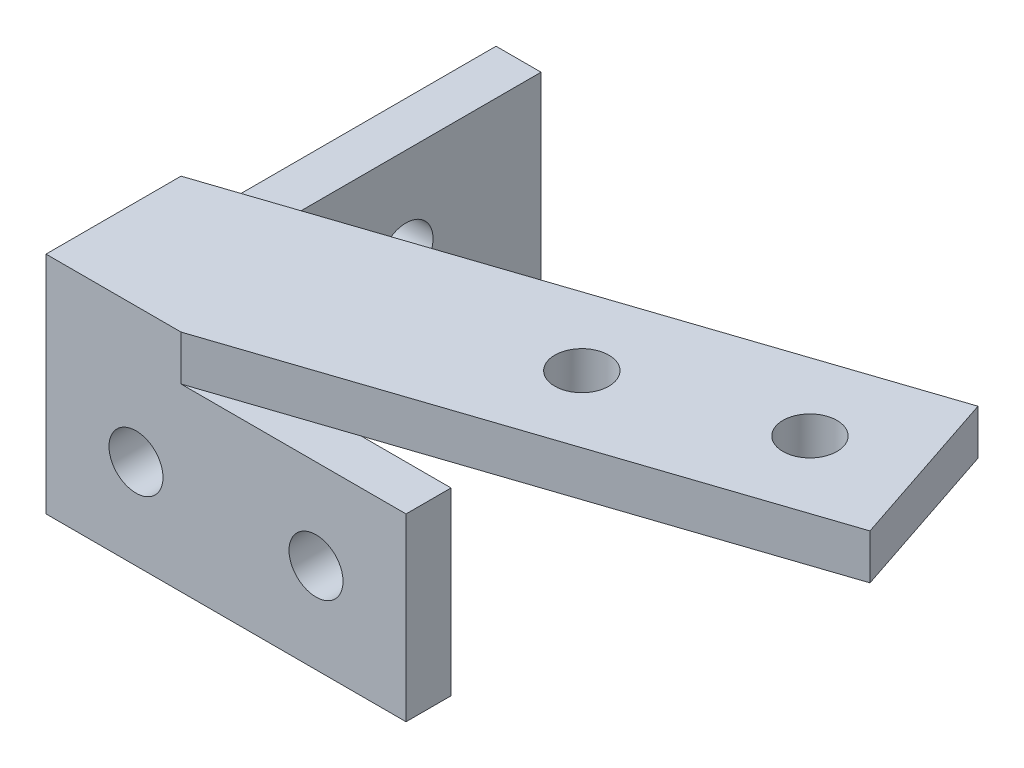
from build123d import *

# Parameters (mm, degrees)
BOSS_EXTRUDE1_DEPTH = 20
BOSS_EXTRUDE5_DEPTH = 5
SKETCH12_R          = 3
CUT_EXTRUDE7_DEPTH  = 89.84196064
SKETCH13_R          = 3
CUT_EXTRUDE8_DEPTH  = 88.571774344
SKETCH14_R          = 3
CUT_EXTRUDE9_DEPTH  = 92.476193463


with BuildPart() as part:
    # Sketch1 → Boss-Extrude1 (new body)
    with BuildSketch(Plane(origin=(0, 0, 0), x_dir=(1, 0, 0), z_dir=(0, 1, 0))):
        Polygon((0, 50), (0, 0), (40, 0), (40, 5), (5, 5), (5, 50), align=None)
    extrude(amount=BOSS_EXTRUDE1_DEPTH)

    # Sketch11 → Boss-Extrude5 (add)
    with BuildSketch(Plane(origin=(0, 20, 0), x_dir=(1, 0, 0), z_dir=(0, 1, 0))):
        Polygon((0, 0), (0, 15), (66.407830872, 37.135943595), (72.407830864, 19.135943596), (15, 0), align=None)
    extrude(amount=BOSS_EXTRUDE5_DEPTH)

    # Sketch12 → Cut-Extrude7 (cut, through all)
    with BuildSketch(Plane(origin=(0, 0, -5), x_dir=(-1, 0, 0), z_dir=(0, 0, -1))):
        with Locations((-10, 10)):
            Circle(SKETCH12_R)
        with Locations((-30, 10)):
            Circle(SKETCH12_R)
    extrude(amount=-CUT_EXTRUDE7_DEPTH, mode=Mode.SUBTRACT)

    # Sketch13 → Cut-Extrude8 (cut, through all)
    with BuildSketch(Plane(origin=(5, 0, 0), x_dir=(0, 0, -1), z_dir=(1, 0, 0))):
        with Locations((15, 10)):
            Circle(SKETCH13_R)
        with Locations((35, 10)):
            Circle(SKETCH13_R)
    extrude(amount=-CUT_EXTRUDE8_DEPTH, mode=Mode.SUBTRACT)

    # Sketch14 → Cut-Extrude9 (cut, through all)
    with BuildSketch(Plane(origin=(0, 25, 0), x_dir=(1, 0, 0), z_dir=(0, 1, 0))):
        with Locations((59.932374432, 24.939536301)):
            Circle(SKETCH14_R)
        with Locations((40.981584196, 18.546763083)):
            Circle(SKETCH14_R)
    extrude(amount=-CUT_EXTRUDE9_DEPTH, mode=Mode.SUBTRACT)


solid = part.part
